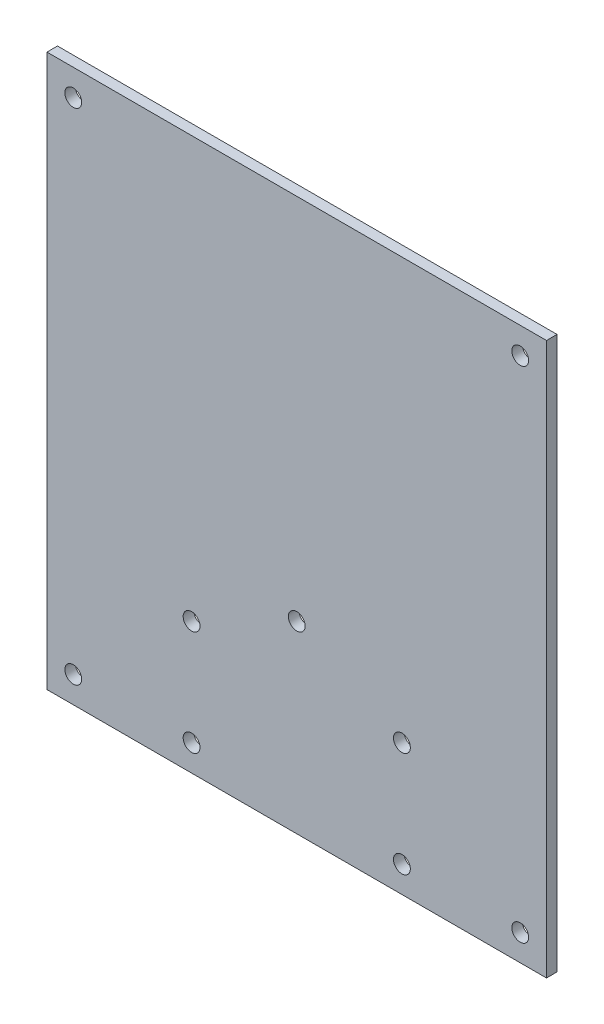
from build123d import *

# Parameters (mm, degrees)
SKETCH_1_R      = 1.6
SKETCH_1_W      = 50
SKETCH_1_H      = 30
EXTRUDE_3_DEPTH = 2


with BuildPart() as part:
    # 草圖1 → 填料-伸長3 (new body)
    # profile 1 of 2: a face of its own
    with BuildSketch(Plane.XY):
        Polygon((-47.5, 105), (-47.5, 0), (-25, 0), (-25, 30), (25, 30), (25, 0), (47.5, 0), (47.5, 105), align=None)
        with Locations((-42.5, 5)):
            Circle(SKETCH_1_R, mode=Mode.SUBTRACT)
        with Locations((42.5, 5)):
            Circle(SKETCH_1_R, mode=Mode.SUBTRACT)
        with Locations((0, 35)):
            Circle(SKETCH_1_R, mode=Mode.SUBTRACT)
        with Locations((-42.5, 100)):
            Circle(SKETCH_1_R, mode=Mode.SUBTRACT)
        with Locations((42.5, 100)):
            Circle(SKETCH_1_R, mode=Mode.SUBTRACT)
    # profile 2 of 2: a face of its own
    with BuildSketch(Plane.XY):
        with Locations((0, 15)):
            Rectangle(SKETCH_1_W, SKETCH_1_H)
        with Locations((-20, 5)):
            Circle(SKETCH_1_R, mode=Mode.SUBTRACT)
        with Locations((-20, 25)):
            Circle(SKETCH_1_R, mode=Mode.SUBTRACT)
        with Locations((20, 5)):
            Circle(SKETCH_1_R, mode=Mode.SUBTRACT)
        with Locations((20, 25)):
            Circle(SKETCH_1_R, mode=Mode.SUBTRACT)
    extrude(amount=EXTRUDE_3_DEPTH)


solid = part.part
